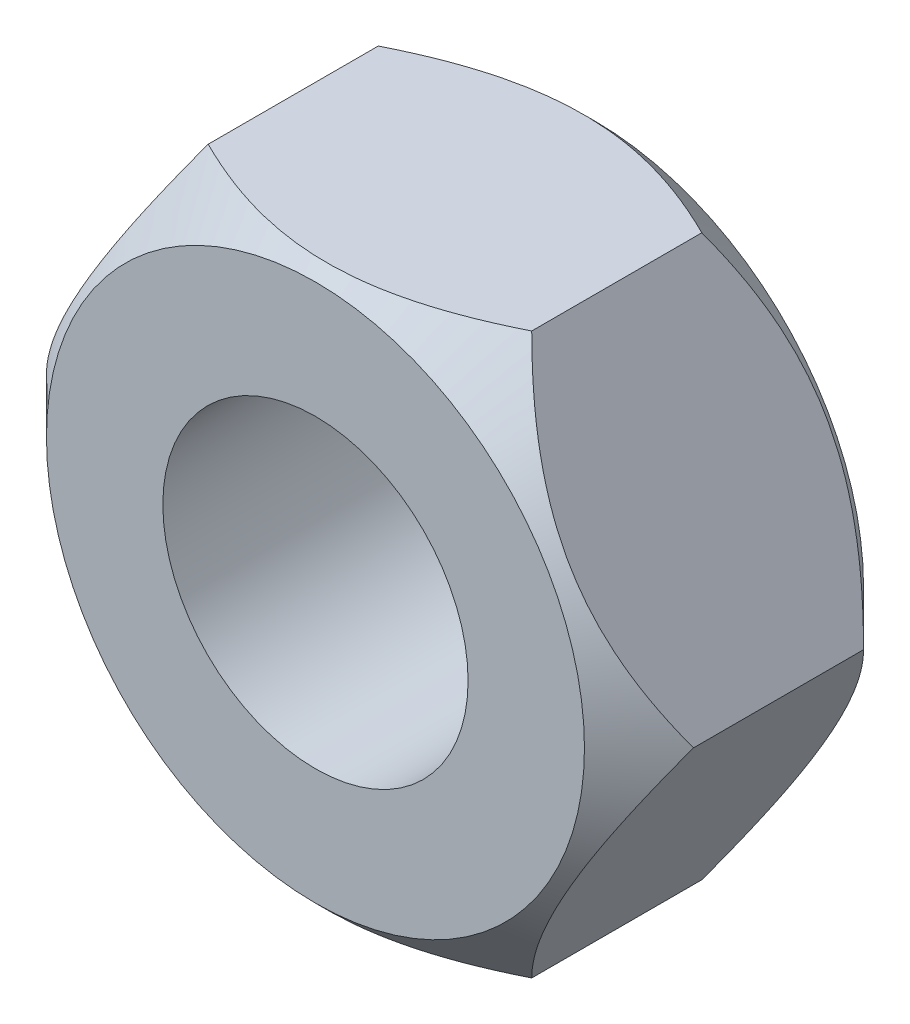
from build123d import *

# Parameters (mm, degrees)
BOSS_EXTRUDE1_DEPTH             = 6.4
TAP_DRILL_FOR_M8X1_0_TAP1_D     = 7
TAP_DRILL_FOR_M8X1_0_TAP1_DEPTH = 16


with BuildPart() as part:
    # Sketch1 → Boss-Extrude1 (new body)
    with BuildSketch(Plane.XY):
        Polygon((7.418950959, 0), (3.70947548, 6.425), (-3.70947548, 6.425), (-7.418950959, 0), (-3.70947548, -6.425), (3.70947548, -6.425), align=None)
    extrude(amount=BOSS_EXTRUDE1_DEPTH)

    # Tap Drill for M8x1.0 Tap1
    with Locations(Plane(origin=(0, 0, 0), x_dir=(-1, 0, 0), z_dir=(0, 0, -1))):
        with Locations((0, 0)):
            Hole(TAP_DRILL_FOR_M8X1_0_TAP1_D / 2, depth=TAP_DRILL_FOR_M8X1_0_TAP1_DEPTH)

    # Sketch4 → Cut-Revolve1 (revolve, cut)
    with BuildSketch(Plane(origin=(0, 0, 0), x_dir=(-1, 0, 0), z_dir=(0, -1, 0))):
        Polygon((-7.418950959, 0), (-7.418950959, -1.25), (-6.168950959, 0), align=None)
        Polygon((-7.418950959, -6.4), (-7.418950959, -5.15), (-6.168950959, -6.4), align=None)
    revolve(axis=Axis((0, 0, 6.4), (0, 0, -1)), mode=Mode.SUBTRACT)


solid = part.part
